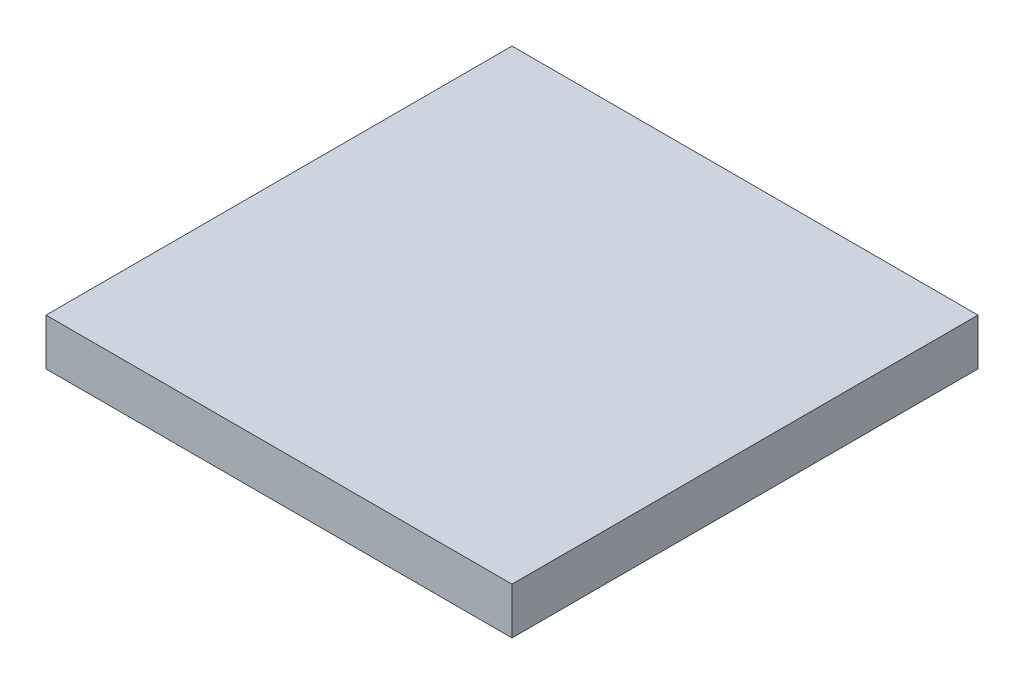
from build123d import *

# Parameters (mm, degrees)
SKETCH1_W           = 20
SKETCH1_H           = 20
BOSS_EXTRUDE1_DEPTH = 2


with BuildPart() as part:
    # Sketch1 → Boss-Extrude1 (new body)
    with BuildSketch(Plane(origin=(0, 0, 0), x_dir=(1, 0, 0), z_dir=(0, 1, 0))):
        with Locations((-15.529411765, 3.450980392)):
            Rectangle(SKETCH1_W, SKETCH1_H)
    extrude(amount=BOSS_EXTRUDE1_DEPTH)


solid = part.part
